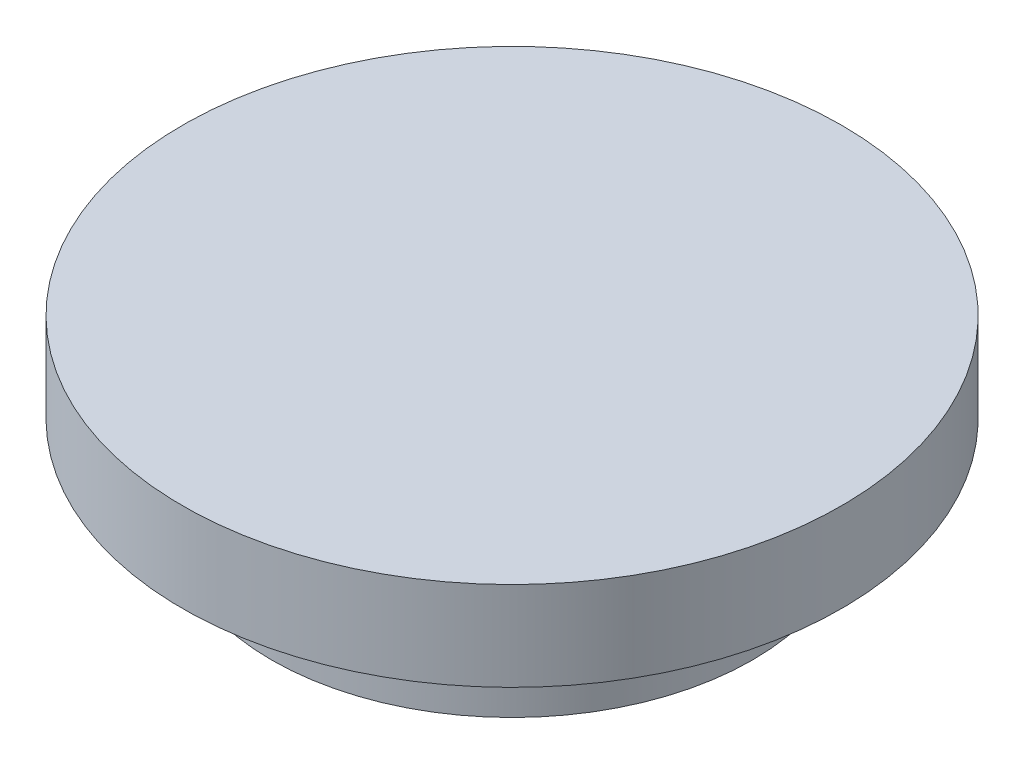
from build123d import *


with BuildPart() as part:
    # Sketch1 → Revolve1 (revolve)
    with BuildSketch(Plane.XY, mode=Mode.PRIVATE) as revolve1_sk:
        Polygon((1.35, 0), (1.35, 0.5), (1.85, 0.5), (1.85, 1), (0, 1), (0, 0), align=None)
    revolve(revolve1_sk.sketch.rotate(Axis((0, 0, 0), (0, 1, 0)), 90), axis=Axis((0, 0, 0), (0, 1, 0)))


solid = part.part
